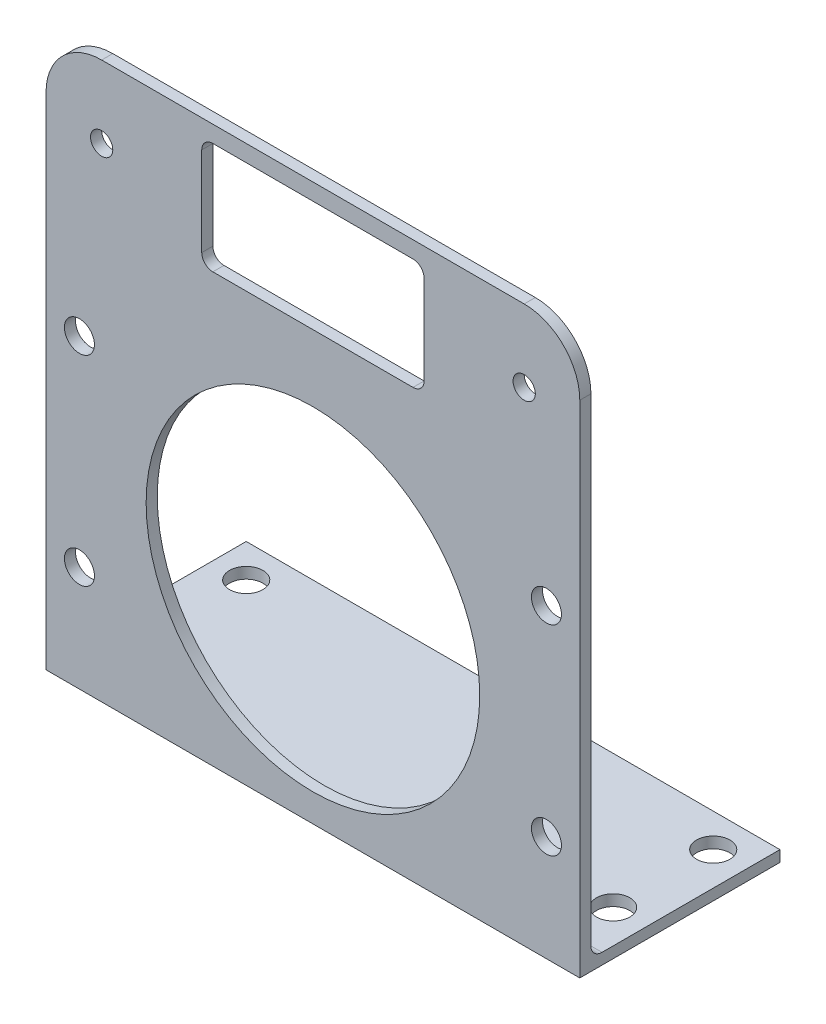
from build123d import *

# Parameters (mm, degrees)
SKETCH1_W           = 48
SKETCH1_H           = 35
BOSS_EXTRUDE1_DEPTH = 1
SKETCH2_W           = 48
SKETCH2_H           = 1
BOSS_EXTRUDE2_DEPTH = 17
FILLET1_R           = 1
SKETCH3_R           = 1.35
SKETCH3_R_2         = 15
CUT_EXTRUDE1_DEPTH  = 35.731109974
SKETCH4_W           = 48
SKETCH4_H           = 1
BOSS_EXTRUDE3_DEPTH = 15
SKETCH5_R           = 1
SKETCH5_W           = 20
SKETCH5_H           = 10
CUT_EXTRUDE2_DEPTH  = 45.229515032
FILLET2_R           = 1
SKETCH6_R           = 1.5
CUT_EXTRUDE3_DEPTH  = 58.148928249
FILLET3_R           = 5


with BuildPart() as part:
    # Sketch1 → Boss-Extrude1 (new body)
    with BuildSketch(Plane.XY):
        Rectangle(SKETCH1_W, SKETCH1_H)
    extrude(amount=BOSS_EXTRUDE1_DEPTH)

    # Sketch2 → Boss-Extrude2 (add)
    with BuildSketch(Plane(origin=(0, 0, 0), x_dir=(-1, 0, 0), z_dir=(0, 0, -1))):
        with Locations((0, -17)):
            Rectangle(SKETCH2_W, SKETCH2_H)
    extrude(amount=BOSS_EXTRUDE2_DEPTH)

    # Fillet1
    fillet1_edges = [part.edges().sort_by_distance(p)[0] for p in [
        (0, -16.5, 0),
    ]]
    fillet(fillet1_edges, radius=FILLET1_R)

    # Sketch3 → Cut-Extrude1 (cut, through all)
    with BuildSketch(Plane.XY.offset(1)):
        with Locations((-21, 10)):
            Circle(SKETCH3_R)
        Circle(SKETCH3_R_2)
        with Locations((-21, -8)):
            Circle(SKETCH3_R)
        with Locations((21, -8)):
            Circle(SKETCH3_R)
        with Locations((21, 10)):
            Circle(SKETCH3_R)
    extrude(amount=-CUT_EXTRUDE1_DEPTH, mode=Mode.SUBTRACT)

    # Sketch4 → Boss-Extrude3 (add)
    with BuildSketch(Plane(origin=(0, 17.5, 0), x_dir=(1, 0, 0), z_dir=(0, 1, 0))):
        with Locations((0, -0.5)):
            Rectangle(SKETCH4_W, SKETCH4_H)
    extrude(amount=BOSS_EXTRUDE3_DEPTH)

    # Sketch5 → Cut-Extrude2 (cut, through all)
    with BuildSketch(Plane.XY.offset(1)):
        with Locations((-19, 26)):
            Circle(SKETCH5_R)
        with Locations((19, 26)):
            Circle(SKETCH5_R)
        with Locations((0, 26)):
            Rectangle(SKETCH5_W, SKETCH5_H)
    extrude(amount=-CUT_EXTRUDE2_DEPTH, mode=Mode.SUBTRACT)

    # Fillet2
    fillet2_edges = [part.edges().sort_by_distance(p)[0] for p in [
        (10, 31, 0.5),
        (10, 21, 0.5),
        (-10, 21, 0.5),
        (-10, 31, 0.5),
    ]]
    fillet(fillet2_edges, radius=FILLET2_R)

    # Sketch6 → Cut-Extrude3 (cut, through all)
    with BuildSketch(Plane(origin=(0, -16.5, 0), x_dir=(1, 0, 0), z_dir=(0, 1, 0))):
        with Locations(Location((21, 5, 0), (0, 0, 270))):
            Circle(SKETCH6_R)
        with Locations(Location((21, 14, 0), (0, 0, 270))):
            Circle(SKETCH6_R)
        with Locations(Location((-21, 5, 0), (0, 0, 90))):
            Circle(SKETCH6_R)
        with Locations(Location((-21, 14, 0), (0, 0, 90))):
            Circle(SKETCH6_R)
    extrude(amount=-CUT_EXTRUDE3_DEPTH, mode=Mode.SUBTRACT)

    # Fillet3
    fillet3_edges = [part.edges().sort_by_distance(p)[0] for p in [
        (24, 32.5, 0.5),
        (-24, 32.5, 0.5),
    ]]
    fillet(fillet3_edges, radius=FILLET3_R)


solid = part.part
